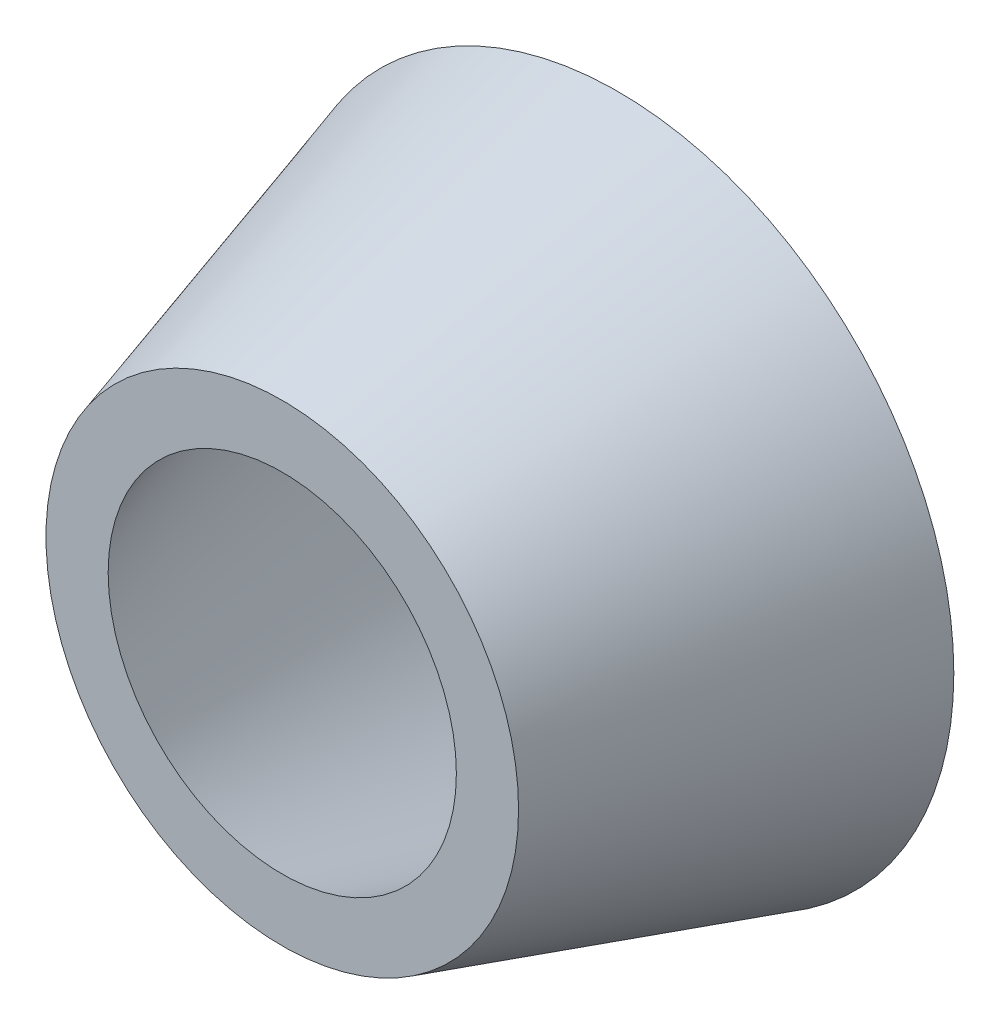
from build123d import *


with BuildPart() as part:
    # Эскиз1 → Повернуть1 (revolve)
    with BuildSketch(Plane(origin=(0, 0, 0), x_dir=(0, 0, -1), z_dir=(1, 0, 0)), mode=Mode.PRIVATE) as revolve_1_sk:
        Polygon((0, 14), (27, 22), (27, 27), (0, 19), align=None)
    revolve(revolve_1_sk.sketch.rotate(Axis((0, 0, 28.213510315), (0, 0, -1)), 90), axis=Axis((0, 0, 28.213510315), (0, 0, -1)))


solid = part.part
